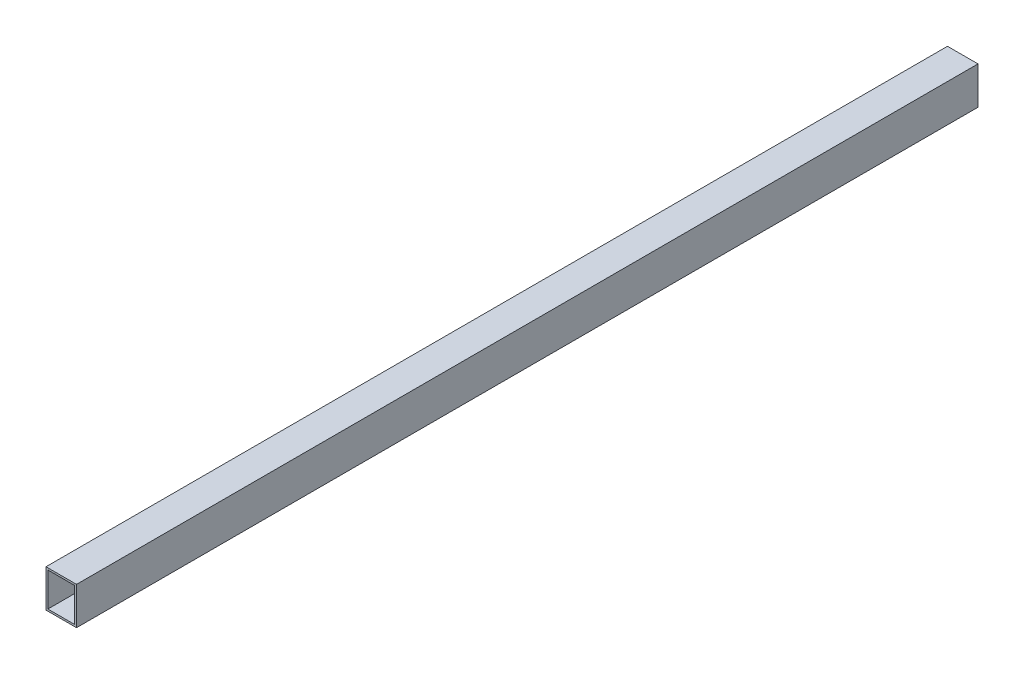
from build123d import *

# Parameters (mm, degrees)
SKETCH4_W           = 1219.2
SKETCH4_H           = 50.8
BOSS_EXTRUDE2_DEPTH = 41.275
SHELL7_T            = -2.54


with BuildPart() as part:
    # Sketch4 → Boss-Extrude2 (new body)
    with BuildSketch(Plane(origin=(0, 0, 0), x_dir=(0, 0, -1), z_dir=(1, 0, 0))):
        with Locations((275.6, -77.4)):
            Rectangle(SKETCH4_W, SKETCH4_H)
    extrude(amount=-BOSS_EXTRUDE2_DEPTH)

    # Shell7
    shell7_openings = [part.faces().sort_by_distance(p)[0] for p in [
        (-20.6375, -77.4, -885.2),
        (-20.6375, -77.4, 334),
    ]]
    offset(amount=SHELL7_T, openings=shell7_openings, kind=Kind.INTERSECTION)


solid = part.part
